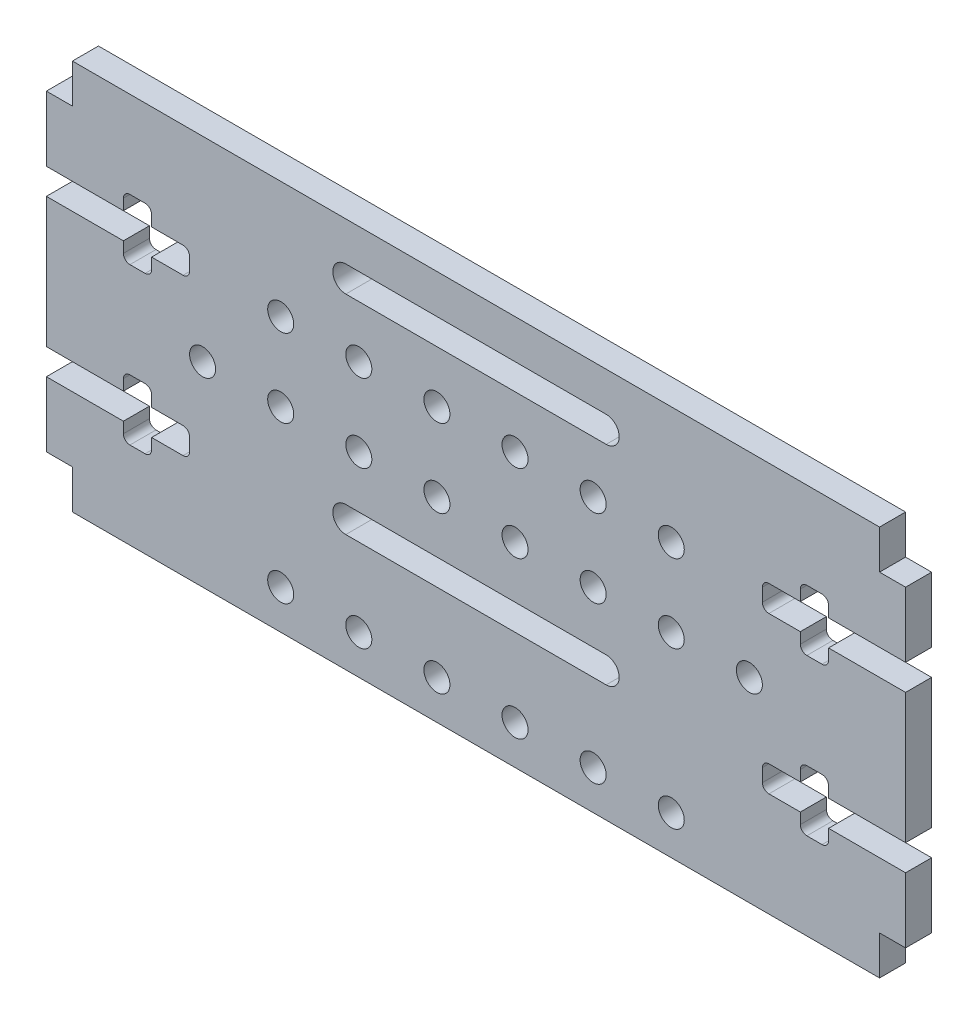
from build123d import *

# Parameters (mm, degrees)
MODEL_R                 = 1.5
SALIENTE_EXTRUIR1_DEPTH = 3


with BuildPart() as part:
    # Model → Saliente-Extruir1 (new body)
    with BuildSketch(Plane.XY):
        with BuildLine():
            Line((-1383.726934946, 374.408179756), (-1386.726934946, 374.408179756))
            Line((-1386.726934946, 374.408179756), (-1386.726934946, 378.908179756))
            Line((-1386.726934946, 378.908179756), (-1479.726934946, 378.908179756))
            Line((-1479.726934946, 378.908179756), (-1479.726934946, 374.408179756))
            Line((-1479.726934946, 374.408179756), (-1482.726934946, 374.408179756))
            Line((-1482.726934946, 374.408179756), (-1482.726934946, 366.908179756))
            Line((-1482.726934946, 366.908179756), (-1473.851934946, 366.908179756))
            Line((-1473.851934946, 366.908179756), (-1473.851934946, 368.158179756))
            ThreePointArc((-1473.851934946, 368.158179756), (-1473.632265032, 368.688509842), (-1473.101934946, 368.908179756))
            Line((-1473.101934946, 368.908179756), (-1471.351934946, 368.908179756))
            ThreePointArc((-1471.351934946, 368.908179756), (-1470.82160486, 368.688509842), (-1470.601934946, 368.158179756))
            Line((-1470.601934946, 368.158179756), (-1470.601934946, 366.908179756))
            Line((-1470.601934946, 366.908179756), (-1466.976934946, 366.908179756))
            ThreePointArc((-1466.976934946, 366.908179756), (-1466.44660486, 366.688509842), (-1466.226934946, 366.158179756))
            Line((-1466.226934946, 366.158179756), (-1466.226934946, 364.658179756))
            ThreePointArc((-1466.226934946, 364.658179756), (-1466.44660486, 364.127849671), (-1466.976934946, 363.908179756))
            Line((-1466.976934946, 363.908179756), (-1470.601934946, 363.908179756))
            Line((-1470.601934946, 363.908179756), (-1470.601934946, 362.658179756))
            ThreePointArc((-1470.601934946, 362.658179756), (-1470.82160486, 362.127849671), (-1471.351934946, 361.908179756))
            Line((-1471.351934946, 361.908179756), (-1473.101934946, 361.908179756))
            ThreePointArc((-1473.101934946, 361.908179756), (-1473.632265032, 362.127849671), (-1473.851934946, 362.658179756))
            Line((-1473.851934946, 362.658179756), (-1473.851934946, 363.908179756))
            Line((-1473.851934946, 363.908179756), (-1482.726934946, 363.908179756))
            Line((-1482.726934946, 363.908179756), (-1482.726934946, 348.908179756))
            Line((-1482.726934946, 348.908179756), (-1473.851934946, 348.908179756))
            Line((-1473.851934946, 348.908179756), (-1473.851934946, 350.158179756))
            ThreePointArc((-1473.851934946, 350.158179756), (-1473.632265032, 350.688509842), (-1473.101934946, 350.908179756))
            Line((-1473.101934946, 350.908179756), (-1471.351934946, 350.908179756))
            ThreePointArc((-1471.351934946, 350.908179756), (-1470.82160486, 350.688509842), (-1470.601934946, 350.158179756))
            Line((-1470.601934946, 350.158179756), (-1470.601934946, 348.908179756))
            Line((-1470.601934946, 348.908179756), (-1466.976934946, 348.908179756))
            ThreePointArc((-1466.976934946, 348.908179756), (-1466.44660486, 348.688509842), (-1466.226934946, 348.158179756))
            Line((-1466.226934946, 348.158179756), (-1466.226934946, 346.658179756))
            ThreePointArc((-1466.226934946, 346.658179756), (-1466.44660486, 346.127849671), (-1466.976934946, 345.908179756))
            Line((-1466.976934946, 345.908179756), (-1470.601934946, 345.908179756))
            Line((-1470.601934946, 345.908179756), (-1470.601934946, 344.658179756))
            ThreePointArc((-1470.601934946, 344.658179756), (-1470.82160486, 344.127849671), (-1471.351934946, 343.908179757))
            Line((-1471.351934946, 343.908179757), (-1473.101934946, 343.908179757))
            ThreePointArc((-1473.101934946, 343.908179757), (-1473.632265032, 344.127849671), (-1473.851934946, 344.658179756))
            Line((-1473.851934946, 344.658179756), (-1473.851934946, 345.908179756))
            Line((-1473.851934946, 345.908179756), (-1482.726934946, 345.908179756))
            Line((-1482.726934946, 345.908179756), (-1482.726934946, 338.408179757))
            Line((-1482.726934946, 338.408179757), (-1479.726934946, 338.408179757))
            Line((-1479.726934946, 338.408179757), (-1479.726934946, 333.908179756))
            Line((-1479.726934946, 333.908179756), (-1386.726934946, 333.908179756))
            Line((-1386.726934946, 333.908179756), (-1386.726934946, 338.408179757))
            Line((-1386.726934946, 338.408179757), (-1383.726934946, 338.408179757))
            Line((-1383.726934946, 338.408179757), (-1383.726934946, 345.908179756))
            Line((-1383.726934946, 345.908179756), (-1392.601934946, 345.908179756))
            Line((-1392.601934946, 345.908179756), (-1392.601934946, 344.658179756))
            ThreePointArc((-1392.601934946, 344.658179756), (-1392.82160486, 344.127849671), (-1393.351934946, 343.908179757))
            Line((-1393.351934946, 343.908179757), (-1395.101934946, 343.908179757))
            ThreePointArc((-1395.101934946, 343.908179757), (-1395.632265032, 344.127849671), (-1395.851934946, 344.658179756))
            Line((-1395.851934946, 344.658179756), (-1395.851934946, 345.908179756))
            Line((-1395.851934946, 345.908179756), (-1399.476934946, 345.908179756))
            ThreePointArc((-1399.476934946, 345.908179756), (-1400.007265032, 346.127849671), (-1400.226934946, 346.658179756))
            Line((-1400.226934946, 346.658179756), (-1400.226934946, 348.158179756))
            ThreePointArc((-1400.226934946, 348.158179756), (-1400.007265032, 348.688509842), (-1399.476934946, 348.908179756))
            Line((-1399.476934946, 348.908179756), (-1395.851934946, 348.908179756))
            Line((-1395.851934946, 348.908179756), (-1395.851934946, 350.158179756))
            ThreePointArc((-1395.851934946, 350.158179756), (-1395.632265032, 350.688509842), (-1395.101934946, 350.908179756))
            Line((-1395.101934946, 350.908179756), (-1393.351934946, 350.908179756))
            ThreePointArc((-1393.351934946, 350.908179756), (-1392.82160486, 350.688509842), (-1392.601934946, 350.158179756))
            Line((-1392.601934946, 350.158179756), (-1392.601934946, 348.908179756))
            Line((-1392.601934946, 348.908179756), (-1383.726934946, 348.908179756))
            Line((-1383.726934946, 348.908179756), (-1383.726934946, 363.908179756))
            Line((-1383.726934946, 363.908179756), (-1392.601934946, 363.908179756))
            Line((-1392.601934946, 363.908179756), (-1392.601934946, 362.658179756))
            ThreePointArc((-1392.601934946, 362.658179756), (-1392.82160486, 362.127849671), (-1393.351934946, 361.908179756))
            Line((-1393.351934946, 361.908179756), (-1395.101934946, 361.908179756))
            ThreePointArc((-1395.101934946, 361.908179756), (-1395.632265032, 362.127849671), (-1395.851934946, 362.658179756))
            Line((-1395.851934946, 362.658179756), (-1395.851934946, 363.908179756))
            Line((-1395.851934946, 363.908179756), (-1399.476934946, 363.908179756))
            ThreePointArc((-1399.476934946, 363.908179756), (-1400.007265032, 364.127849671), (-1400.226934946, 364.658179756))
            Line((-1400.226934946, 364.658179756), (-1400.226934946, 366.158179756))
            ThreePointArc((-1400.226934946, 366.158179756), (-1400.007265032, 366.688509842), (-1399.476934946, 366.908179756))
            Line((-1399.476934946, 366.908179756), (-1395.851934946, 366.908179756))
            Line((-1395.851934946, 366.908179756), (-1395.851934946, 368.158179756))
            ThreePointArc((-1395.851934946, 368.158179756), (-1395.632265032, 368.688509842), (-1395.101934946, 368.908179756))
            Line((-1395.101934946, 368.908179756), (-1393.351934946, 368.908179756))
            ThreePointArc((-1393.351934946, 368.908179756), (-1392.82160486, 368.688509842), (-1392.601934946, 368.158179756))
            Line((-1392.601934946, 368.158179756), (-1392.601934946, 366.908179756))
            Line((-1392.601934946, 366.908179756), (-1383.726934946, 366.908179756))
            Line((-1383.726934946, 366.908179756), (-1383.726934946, 374.408179756))
        make_face()
        with Locations((-1401.727545355, 356.408179756)):
            Circle(MODEL_R, mode=Mode.SUBTRACT)
        with Locations((-1464.727545355, 356.408179756)):
            Circle(MODEL_R, mode=Mode.SUBTRACT)
        with Locations((-1455.727545355, 356.408179756)):
            Circle(MODEL_R, mode=Mode.SUBTRACT)
        with Locations((-1410.727545355, 356.408179756)):
            Circle(MODEL_R, mode=Mode.SUBTRACT)
        with Locations((-1446.727545355, 356.408179756)):
            Circle(MODEL_R, mode=Mode.SUBTRACT)
        with Locations((-1437.727545355, 356.408179756)):
            Circle(MODEL_R, mode=Mode.SUBTRACT)
        with Locations((-1428.727545355, 356.408179756)):
            Circle(MODEL_R, mode=Mode.SUBTRACT)
        with Locations((-1419.727545355, 356.408179756)):
            Circle(MODEL_R, mode=Mode.SUBTRACT)
        with Locations((-1455.727545355, 365.408179756)):
            Circle(MODEL_R, mode=Mode.SUBTRACT)
        with Locations((-1446.727545355, 365.408179756)):
            Circle(MODEL_R, mode=Mode.SUBTRACT)
        with Locations((-1437.727545355, 365.408179756)):
            Circle(MODEL_R, mode=Mode.SUBTRACT)
        with Locations((-1428.727545355, 365.408179756)):
            Circle(MODEL_R, mode=Mode.SUBTRACT)
        with Locations((-1419.727545355, 365.408179756)):
            Circle(MODEL_R, mode=Mode.SUBTRACT)
        with Locations((-1410.727545355, 365.408179756)):
            Circle(MODEL_R, mode=Mode.SUBTRACT)
        with Locations((-1455.727545355, 338.408179757)):
            Circle(MODEL_R, mode=Mode.SUBTRACT)
        with Locations((-1446.727545355, 338.408179757)):
            Circle(MODEL_R, mode=Mode.SUBTRACT)
        with Locations((-1437.727545355, 338.408179757)):
            Circle(MODEL_R, mode=Mode.SUBTRACT)
        with Locations((-1428.727545355, 338.408179757)):
            Circle(MODEL_R, mode=Mode.SUBTRACT)
        with Locations((-1419.727545355, 338.408179757)):
            Circle(MODEL_R, mode=Mode.SUBTRACT)
        with Locations((-1410.727545355, 338.408179757)):
            Circle(MODEL_R, mode=Mode.SUBTRACT)
        with BuildLine():
            Line((-1448.226934946, 350.408179756), (-1418.226934946, 350.408179756))
            ThreePointArc((-1418.226934946, 350.408179756), (-1416.726934946, 348.908179756), (-1418.226934946, 347.408179756))
            Line((-1418.226934946, 347.408179756), (-1448.226934946, 347.408179756))
            ThreePointArc((-1448.226934946, 347.408179756), (-1449.726934946, 348.908179756), (-1448.226934946, 350.408179756))
        make_face(mode=Mode.SUBTRACT)
        with BuildLine():
            Line((-1448.226934946, 374.408179756), (-1418.226934946, 374.408179756))
            ThreePointArc((-1418.226934946, 374.408179756), (-1416.726934946, 372.908179756), (-1418.226934946, 371.408179756))
            Line((-1418.226934946, 371.408179756), (-1448.226934946, 371.408179756))
            ThreePointArc((-1448.226934946, 371.408179756), (-1449.726934946, 372.908179756), (-1448.226934946, 374.408179756))
        make_face(mode=Mode.SUBTRACT)
    extrude(amount=SALIENTE_EXTRUIR1_DEPTH)


solid = part.part
